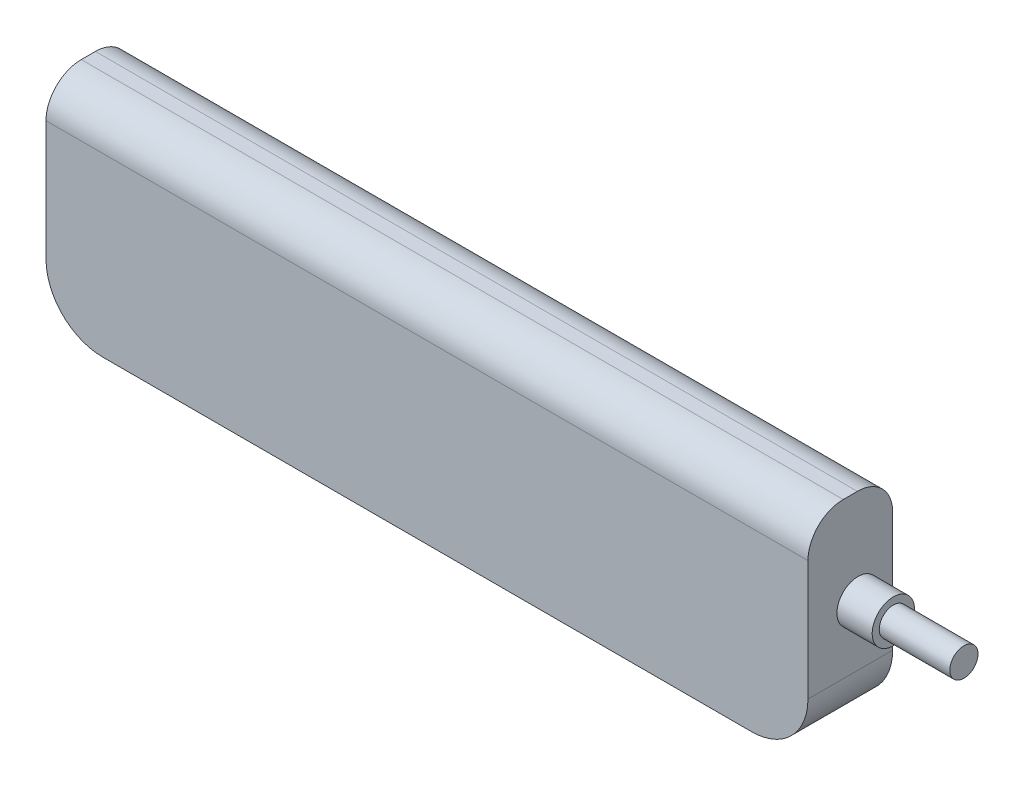
from build123d import *

# Parameters (mm, degrees)
SKETCH_1_W          = 108
SKETCH_1_H          = 30
EXTRUDE_1_DEPTH     = 12
SKETCH_2_W          = 5
SKETCH_2_H          = 12
CUT_EXTRUDE_1_DEPTH = 8
SKETCH_3_W          = 0.8
SKETCH_3_H          = 10
EXTRUDE_2_DEPTH     = 6
SKETCH_4_W          = 11
SKETCH_4_H          = 5
CUT_EXTRUDE_2_DEPTH = 8
SKETCH_5_W          = 10
SKETCH_5_H          = 0.8
EXTRUDE_3_DEPTH     = 6
SKETCH_6_W          = 11
SKETCH_6_H          = 5
CUT_EXTRUDE_3_DEPTH = 8
SKETCH_7_W          = 10
SKETCH_7_H          = 0.8
EXTRUDE_4_DEPTH     = 6
SKETCH_8_W          = 11
SKETCH_8_H          = 5
CUT_EXTRUDE_4_DEPTH = 8
SKETCH_9_W          = 10
SKETCH_9_H          = 0.8
EXTRUDE_5_DEPTH     = 6
FILLET_1_R          = 5
FILLET_2_R          = 8


with BuildPart() as part:
    # 草图1 → 凸台-拉伸1 (new body)
    with BuildSketch(Plane(origin=(0, 0, 0), x_dir=(-1, 0, 0), z_dir=(0, 0, -1))):
        Rectangle(SKETCH_1_W, SKETCH_1_H)
    extrude(amount=-EXTRUDE_1_DEPTH)

    # 草图2 → 切除-拉伸1 (cut)
    with BuildSketch(Plane.ZY.offset(54)):
        with Locations((6, 4)):
            Rectangle(SKETCH_2_W, SKETCH_2_H)
    extrude(amount=-CUT_EXTRUDE_1_DEPTH, mode=Mode.SUBTRACT)

    # 草图3 → 凸台-拉伸2 (add)
    with BuildSketch(Plane.ZY.offset(46)):
        with Locations((7.7, 4)):
            Rectangle(SKETCH_3_W, SKETCH_3_H)
    extrude(amount=EXTRUDE_2_DEPTH)

    # 草图4 → 切除-拉伸2 (cut)
    with BuildSketch(Plane.XZ.offset(15)):
        with Locations((-34.5, 6)):
            Rectangle(SKETCH_4_W, SKETCH_4_H)
    extrude(amount=-CUT_EXTRUDE_2_DEPTH, mode=Mode.SUBTRACT)

    # 草图5 → 凸台-拉伸3 (add)
    with BuildSketch(Plane.XZ.offset(7)):
        with Locations((-34.5, 7.8)):
            Rectangle(SKETCH_5_W, SKETCH_5_H)
    extrude(amount=EXTRUDE_3_DEPTH)

    # 草图6 → 切除-拉伸3 (cut)
    with BuildSketch(Plane.XZ.offset(15)):
        with Locations((-3.5, 6)):
            Rectangle(SKETCH_6_W, SKETCH_6_H)
    extrude(amount=-CUT_EXTRUDE_3_DEPTH, mode=Mode.SUBTRACT)

    # 草图7 → 凸台-拉伸4 (add)
    with BuildSketch(Plane.XZ.offset(7)):
        with Locations((-3.5, 7.8)):
            Rectangle(SKETCH_7_W, SKETCH_7_H)
    extrude(amount=EXTRUDE_4_DEPTH)

    # 草图8 → 切除-拉伸4 (cut)
    with BuildSketch(Plane.XZ.offset(15)):
        with Locations((17.5, 6)):
            Rectangle(SKETCH_8_W, SKETCH_8_H)
    extrude(amount=-CUT_EXTRUDE_4_DEPTH, mode=Mode.SUBTRACT)

    # 草图9 → 凸台-拉伸5 (add)
    with BuildSketch(Plane.XZ.offset(7)):
        with Locations((17.5, 7.8)):
            Rectangle(SKETCH_9_W, SKETCH_9_H)
    extrude(amount=EXTRUDE_5_DEPTH)

    # 草图10 → 旋转1 (revolve)
    with BuildSketch(Plane.XY.offset(4.899865492)):
        Polygon((54, 4.5), (54, 1.5), (69, 1.5), (69, 3.5), (59, 3.5), (59, 4.5), align=None)
    revolve(axis=Axis((54, 1.5, 4.899865492), (1, 0, 0)))

    # 圆角1
    fillet_1_edges = [part.edges().sort_by_distance(p)[0] for p in [
        (0, 15, 12),
        (0, 15, 0),
    ]]
    fillet(fillet_1_edges, radius=FILLET_1_R)

    # 圆角2
    fillet_2_edges = [part.edges().sort_by_distance(p)[0] for p in [
        (-54, -15, 6),
        (54, -15, 6),
    ]]
    fillet(fillet_2_edges, radius=FILLET_2_R)


solid = part.part
